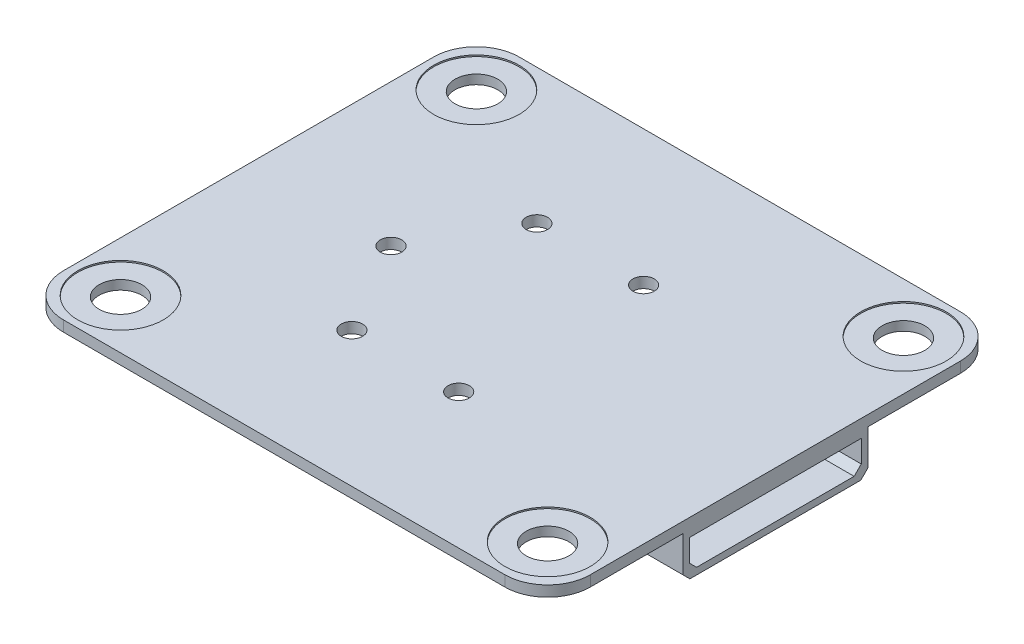
from build123d import *

# Parameters (mm, degrees)
BOSS_EXTRUDE1_DEPTH = 0.75
CUT_EXTRUDE3_DEPTH  = 0.1
SKETCH3_R           = 1.5
CUT_EXTRUDE4_DEPTH  = 3.1
SKETCH4_R           = 0.75
CUT_EXTRUDE5_DEPTH  = 10
SKETCH6_W           = 6.340818297
SKETCH6_H           = 13.007496706
BOSS_EXTRUDE2_DEPTH = 3
SKETCH7_W           = 12.068220188
SKETCH7_H           = 2.061032276
CUT_EXTRUDE6_DEPTH  = 5
CHAMFER2_SIZE       = 0.5


with BuildPart() as part:
    # Sketch1 → Boss-Extrude1 (new body)
    with BuildSketch(Plane(origin=(0, 0, 0), x_dir=(1, 0, 0), z_dir=(0, 1, 0))):
        with BuildLine():
            Line((-15.5, 16), (15.5, 16))
            ThreePointArc((15.5, 16), (17.621320344, 15.121320344), (18.5, 13))
            Line((18.5, 13), (18.5, -13))
            ThreePointArc((18.5, -13), (17.621320344, -15.121320344), (15.5, -16))
            Line((15.5, -16), (-15.5, -16))
            ThreePointArc((-15.5, -16), (-17.621320344, -15.121320344), (-18.5, -13))
            Line((-18.5, -13), (-18.5, 13))
            ThreePointArc((-18.5, 13), (-17.621320344, 15.121320344), (-15.5, 16))
        make_face()
    extrude(amount=BOSS_EXTRUDE1_DEPTH)

    # Sketch2 → Cut-Extrude3 (cut)
    with BuildSketch(Plane(origin=(0, 0.75, 0), x_dir=(1, 0, 0), z_dir=(0, 1, 0))):
        with BuildLine():
            ThreePointArc((-15, 11), (-16.060660172, 13.560660172), (-13.5, 12.5))
            Line((-13.5, 12.5), (-12, 12.5))
            ThreePointArc((-12, 12.5), (-17.121320344, 14.621320344), (-15, 9.5))
            Line((-15, 9.5), (-15, 11))
        make_face()
        with BuildLine():
            Line((-12, 12.5), (-13.5, 12.5))
            ThreePointArc((-13.5, 12.5), (-13.939339828, 11.439339828), (-15, 11))
            Line((-15, 11), (-15, 9.5))
            ThreePointArc((-15, 9.5), (-12.878679656, 10.378679656), (-12, 12.5))
        make_face()
        with BuildLine():
            ThreePointArc((18, 12.5), (15, 15.5), (12, 12.5))
            Line((12, 12.5), (13.5, 12.5))
            ThreePointArc((13.5, 12.5), (15, 14), (16.5, 12.5))
            ThreePointArc((16.5, 12.5), (16.060660172, 11.439339828), (15, 11))
            Line((15, 11), (15, 9.5))
            ThreePointArc((15, 9.5), (17.121320344, 10.378679656), (18, 12.5))
        make_face()
        with BuildLine():
            Line((13.5, 12.5), (12, 12.5))
            ThreePointArc((12, 12.5), (12.878679656, 10.378679656), (15, 9.5))
            Line((15, 9.5), (15, 11))
            ThreePointArc((15, 11), (13.939339828, 11.439339828), (13.5, 12.5))
        make_face()
        with BuildLine():
            ThreePointArc((18, -12.5), (17.121320344, -10.378679656), (15, -9.5))
            Line((15, -9.5), (15, -11))
            ThreePointArc((15, -11), (16.060660172, -11.439339828), (16.5, -12.5))
            ThreePointArc((16.5, -12.5), (15, -14), (13.5, -12.5))
            Line((13.5, -12.5), (12, -12.5))
            ThreePointArc((12, -12.5), (15, -15.5), (18, -12.5))
        make_face()
        with BuildLine():
            Line((15, -11), (15, -9.5))
            ThreePointArc((15, -9.5), (12.878679656, -10.378679656), (12, -12.5))
            Line((12, -12.5), (13.5, -12.5))
            ThreePointArc((13.5, -12.5), (13.939339828, -11.439339828), (15, -11))
        make_face()
        with BuildLine():
            ThreePointArc((-12, -12.5), (-12.878679656, -10.378679656), (-15, -9.5))
            Line((-15, -9.5), (-15, -11))
            ThreePointArc((-15, -11), (-13.939339828, -11.439339828), (-13.5, -12.5))
            Line((-13.5, -12.5), (-12, -12.5))
        make_face()
        with BuildLine():
            Line((-15, -11), (-15, -9.5))
            ThreePointArc((-15, -9.5), (-17.121320344, -14.621320344), (-12, -12.5))
            Line((-12, -12.5), (-13.5, -12.5))
            ThreePointArc((-13.5, -12.5), (-16.060660172, -13.560660172), (-15, -11))
        make_face()
    extrude(amount=-CUT_EXTRUDE3_DEPTH, mode=Mode.SUBTRACT)

    # Sketch3 → Cut-Extrude4 (cut)
    with BuildSketch(Plane(origin=(0, 0.75, 0), x_dir=(1, 0, 0), z_dir=(0, 1, 0))):
        with Locations(Location((-15, 12.5, 0), (0, 0, 270))):
            Circle(SKETCH3_R)
        with Locations(Location((15, 12.5, 0), (0, 0, 270))):
            Circle(SKETCH3_R)
        with Locations(Location((-15, -12.5, 0), (0, 0, 270))):
            Circle(SKETCH3_R)
        with Locations(Location((15, -12.5, 0), (0, 0, 270))):
            Circle(SKETCH3_R)
    extrude(amount=-CUT_EXTRUDE4_DEPTH, mode=Mode.SUBTRACT)

    # Sketch4 → Cut-Extrude5 (cut)
    with BuildSketch(Plane(origin=(0, 0.75, 0), x_dir=(1, 0, 0), z_dir=(0, 1, 0))):
        with Locations(Location((2.75, -6.495190528, 0), (0, 0, 270))):
            Circle(SKETCH4_R)
        with Locations(Location((-4.75, -6.495190528, 0), (0, 0, 270))):
            Circle(SKETCH4_R)
        with Locations(Location((-8.5, 0, 0), (0, 0, 270))):
            Circle(SKETCH4_R)
        with Locations(Location((-4.75, 6.495190528, 0), (0, 0, 270))):
            Circle(SKETCH4_R)
        with Locations(Location((2.75, 6.495190528, 0), (0, 0, 270))):
            Circle(SKETCH4_R)
    extrude(amount=-CUT_EXTRUDE5_DEPTH, mode=Mode.SUBTRACT)

    # Sketch6 → Boss-Extrude2 (add)
    with BuildSketch(Plane.XZ):
        with Locations((15.329590852, 0)):
            Rectangle(SKETCH6_W, SKETCH6_H)
    extrude(amount=BOSS_EXTRUDE2_DEPTH)

    # Sketch7 → Cut-Extrude6 (cut)
    with BuildSketch(Plane(origin=(18.5, 0, 0), x_dir=(0, 0, -1), z_dir=(1, 0, 0))):
        with Locations((0, -1.5)):
            Rectangle(SKETCH7_W, SKETCH7_H)
    extrude(amount=-CUT_EXTRUDE6_DEPTH, mode=Mode.SUBTRACT)

    # Chamfer2
    chamfer2_edges = [part.edges().sort_by_distance(p)[0] for p in [
        (15.329590852, -3, -6.503748353),
        (15.329590852, -3, 6.503748353),
        (16, -2.530516138, 6.034110094),
        (16, -2.530516138, -6.034110094),
    ]]
    chamfer(chamfer2_edges, length=CHAMFER2_SIZE)


solid = part.part
